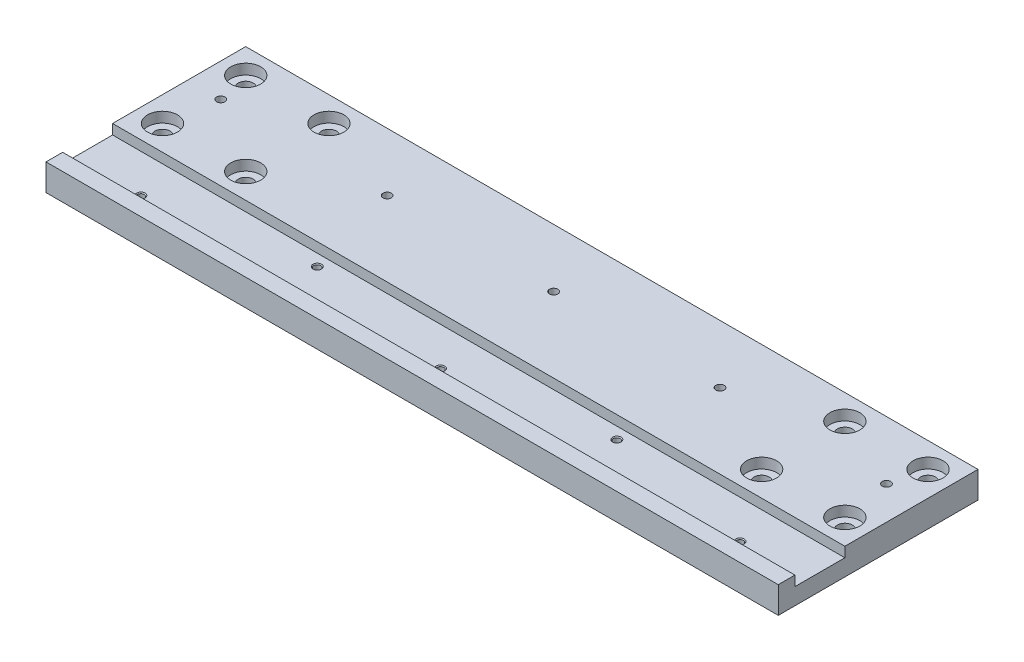
from build123d import *

# Parameters (mm, degrees)
SKIZZE1_W                                            = 220
SKIZZE1_H                                            = 60
AUFSATZ_LINEAR_AUSTRAGEN1_DEPTH                      = 8
STIRNSENKUNG_F_R_M4_FLACHKOPFSCHRAUBE_MI_D           = 4.5
STIRNSENKUNG_F_R_M4_FLACHKOPFSCHRAUBE_MI_DEPTH       = 11.5
STIRNSENKUNG_F_R_M4_FLACHKOPFSCHRAUBE_MI_CBORE_D     = 9
STIRNSENKUNG_F_R_M4_FLACHKOPFSCHRAUBE_MI_CBORE_DEPTH = 3.1
STIRNSENKUNG_F_R_M4_FLACHKOPFSCHRAUBE_MI_TIP         = 1.351936393
M3_GEWINDEBOHRUNG1_D                                 = 2.5
M3_GEWINDEBOHRUNG1_DEPTH                             = 8.5
M3_GEWINDEBOHRUNG1_TIP                               = 0.751075774
SKIZZE8_W                                            = 15
SKIZZE8_H                                            = 3
SCHNITT_LINEAR_AUSTRAGEN1_DEPTH                      = 223.18010712
M2_5_GEWINDEBOHRUNG1_D                               = 2.05
M2_5_GEWINDEBOHRUNG1_CSINK_D                         = 2.55
M2_5_GEWINDEBOHRUNG1_CSINK_ANGLE                     = 90


with BuildPart() as part:
    # Skizze1 → Aufsatz-Linear austragen1 (new body)
    with BuildSketch(Plane(origin=(0, 0, 0), x_dir=(1, 0, 0), z_dir=(0, 1, 0))):
        Rectangle(SKIZZE1_W, SKIZZE1_H)
    extrude(amount=AUFSATZ_LINEAR_AUSTRAGEN1_DEPTH)

    # Stirnsenkung für M4 Flachkopfschraube mit Schlitz1
    with Locations(Plane(origin=(0, 8, 0), x_dir=(1, 0, 0), z_dir=(0, 1, 0))):
        with Locations((-102.5, 22.5), (-77.5, 22.5), (-77.5, -2.5), (-102.5, -2.5), (102.5, -2.5), (77.5, -2.5), (77.5, 22.5), (102.5, 22.5)):
            CounterBoreHole(STIRNSENKUNG_F_R_M4_FLACHKOPFSCHRAUBE_MI_D / 2, STIRNSENKUNG_F_R_M4_FLACHKOPFSCHRAUBE_MI_CBORE_D / 2, STIRNSENKUNG_F_R_M4_FLACHKOPFSCHRAUBE_MI_CBORE_DEPTH, depth=STIRNSENKUNG_F_R_M4_FLACHKOPFSCHRAUBE_MI_DEPTH)
            with Locations((0, 0, -(STIRNSENKUNG_F_R_M4_FLACHKOPFSCHRAUBE_MI_DEPTH + STIRNSENKUNG_F_R_M4_FLACHKOPFSCHRAUBE_MI_TIP / 2))):  # 118° drill point
                Cone(0, STIRNSENKUNG_F_R_M4_FLACHKOPFSCHRAUBE_MI_D / 2, STIRNSENKUNG_F_R_M4_FLACHKOPFSCHRAUBE_MI_TIP, mode=Mode.SUBTRACT)

    # M3 Gewindebohrung1
    with Locations(Plane(origin=(0, 8, 0), x_dir=(1, 0, 0), z_dir=(0, 1, 0))):
        with Locations((-50, 12.5), (0, 12.5), (50, 12.5), (100, 12.5), (-100, 12.5), (150, 12.5), (200, 12.5)):
            Hole(M3_GEWINDEBOHRUNG1_D / 2, depth=M3_GEWINDEBOHRUNG1_DEPTH)
            with Locations((0, 0, -(M3_GEWINDEBOHRUNG1_DEPTH + M3_GEWINDEBOHRUNG1_TIP / 2))):  # 118° drill point
                Cone(0, M3_GEWINDEBOHRUNG1_D / 2, M3_GEWINDEBOHRUNG1_TIP, mode=Mode.SUBTRACT)

    # Skizze8 → Schnitt-Linear austragen1 (cut, through all)
    with BuildSketch(Plane.ZY.offset(110)):
        with Locations((17.5, 6.5)):
            Rectangle(SKIZZE8_W, SKIZZE8_H)
    extrude(amount=-SCHNITT_LINEAR_AUSTRAGEN1_DEPTH, mode=Mode.SUBTRACT)

    # M2.5 Gewindebohrung1 (through all)
    with Locations(Plane(origin=(0, 5, 0), x_dir=(1, 0, 0), z_dir=(0, 1, 0))):
        with Locations((-90, -21.5), (0, -21.5), (90, -21.5), (45, -13.5), (-45, -13.5)):
            CounterSinkHole(M2_5_GEWINDEBOHRUNG1_D / 2, M2_5_GEWINDEBOHRUNG1_CSINK_D / 2, counter_sink_angle=M2_5_GEWINDEBOHRUNG1_CSINK_ANGLE)


solid = part.part
